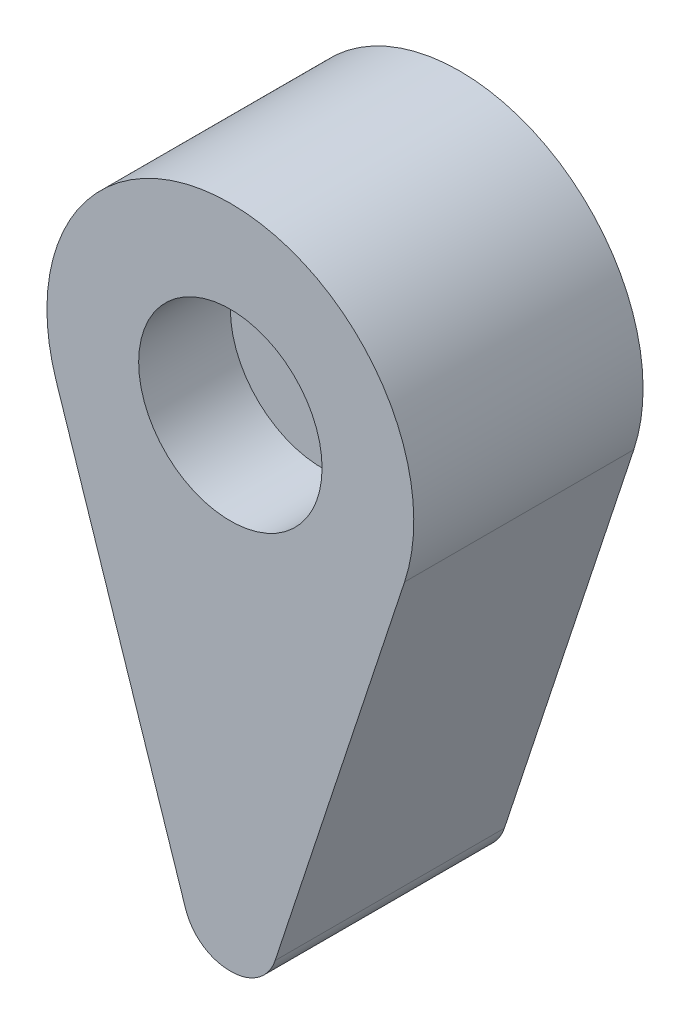
from build123d import *

# Parameters (mm, degrees)
EXTRUDE_1_DEPTH     = 10
FILLET_1_R          = 2
SKETCH_4_R          = 4
CUT_EXTRUDE_1_DEPTH = 4
M4X0_71_D           = 3.3


with BuildPart() as part:
    # Эскиз1 → Бобышка-Вытянуть1 (new body)
    with BuildSketch(Plane.XY):
        with BuildLine():
            Line((-1.5, -21), (-7.597720185, -2.504924749))
            ThreePointArc((-7.597720185, -2.504924749), (0, 8), (7.597720185, -2.504924749))
            Line((7.597720185, -2.504924749), (1.5, -21))
            Line((1.5, -21), (-1.5, -21))
        make_face()
    extrude(amount=EXTRUDE_1_DEPTH)

    # Скругление1
    fillet_1_edges = [part.edges().sort_by_distance(p)[0] for p in [
        (-1.5, -21, 5),
        (1.5, -21, 5),
    ]]
    fillet(fillet_1_edges, radius=FILLET_1_R)

    # Эскиз4 → Вырез-Вытянуть1 (cut)
    with BuildSketch(Plane.XY.offset(10)):
        Circle(SKETCH_4_R)
    extrude(amount=-CUT_EXTRUDE_1_DEPTH, mode=Mode.SUBTRACT)

    # Отверстие обработанное метчиком M4x0.71 (through all)
    with Locations(Plane.XY.offset(6)):
        with Locations((0, 0)):
            Hole(M4X0_71_D / 2)


solid = part.part
